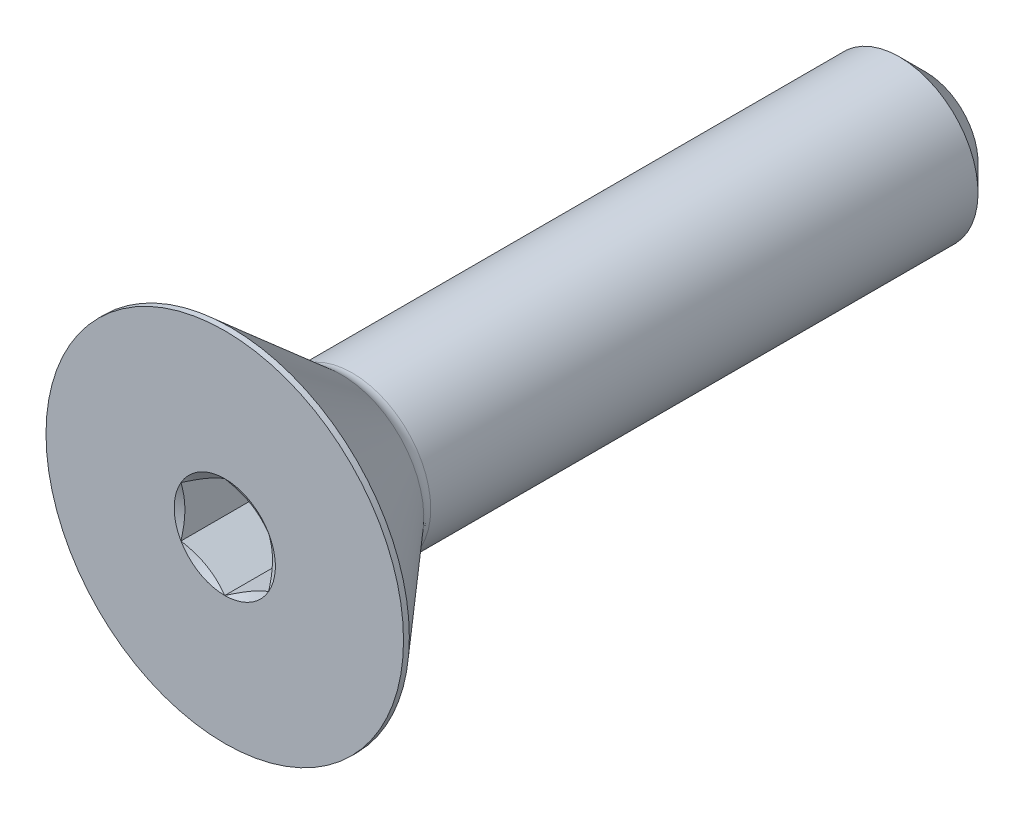
from build123d import *

# Parameters (mm, degrees)
SKETCH1_W          = 12.7
SKETCH1_H          = 1.4224
CHAMFER1_SIZE      = 0.47625
CUT_EXTRUDE2_DEPTH = 1.47574


with BuildPart() as part:
    # Sketch1 → Revolve1 (revolve)
    with BuildSketch(Plane(origin=(0, 0, 0), x_dir=(0, 0, -1), z_dir=(1, 0, 0))):
        with Locations((6.35, 0.7112)):
            Rectangle(SKETCH1_W, SKETCH1_H)
    revolve(axis=Axis((0, 0, -12.7), (0, 0, 1)))

    # Chamfer1
    chamfer1_edges = [part.edges().sort_by_distance(p)[0] for p in [
        (0, -1.4224, -12.7),
    ]]
    chamfer(chamfer1_edges, length=CHAMFER1_SIZE)

    # Sketch7 → Revolve2 (revolve)
    with BuildSketch(Plane(origin=(0, 0, 0), x_dir=(0, 0, -1), z_dir=(1, 0, 0)), mode=Mode.PRIVATE) as revolve2_sk:
        with BuildLine():
            Line((0, 3.2385), (0.10541, 3.2385))
            Line((0.10541, 3.2385), (2.1082, 1.497501214))
            ThreePointArc((2.1082, 1.497501214), (2.201843405, 1.441789243), (2.309067322, 1.4224))
            Line((2.309067322, 1.4224), (2.309067322, 0))
            Line((2.309067322, 0), (0, 0))
            Line((0, 0), (0, 3.2385))
        make_face()
    revolve(revolve2_sk.sketch.rotate(Axis((0, 0, 0), (0, 0, -1)), 180), axis=Axis((0, 0, 0), (0, 0, -1)))

    # Sketch5 → Cut-Extrude2 (cut)
    with BuildSketch(Plane.XY):
        Polygon((0, 0.916543552), (-0.79375, 0.458271776), (-0.79375, -0.458271776), (0, -0.916543552), (0.79375, -0.458271776), (0.79375, 0.458271776), align=None)
    extrude(amount=-CUT_EXTRUDE2_DEPTH, mode=Mode.SUBTRACT)

    # Cut-Extrude3 cone 1 section (through the dimple's axis) → Cut-Extrude3 (revolve, cut)
    with BuildSketch(Plane(origin=(0, 0, 0), x_dir=(0, -1, 0), z_dir=(1, 0, 0))):
        Polygon((0, 0), (0.916543552, 0), (0, 0.529166667), align=None)
    revolve(axis=Axis((0, 0, 0), (0, 0, -1)), mode=Mode.SUBTRACT)


solid = part.part
